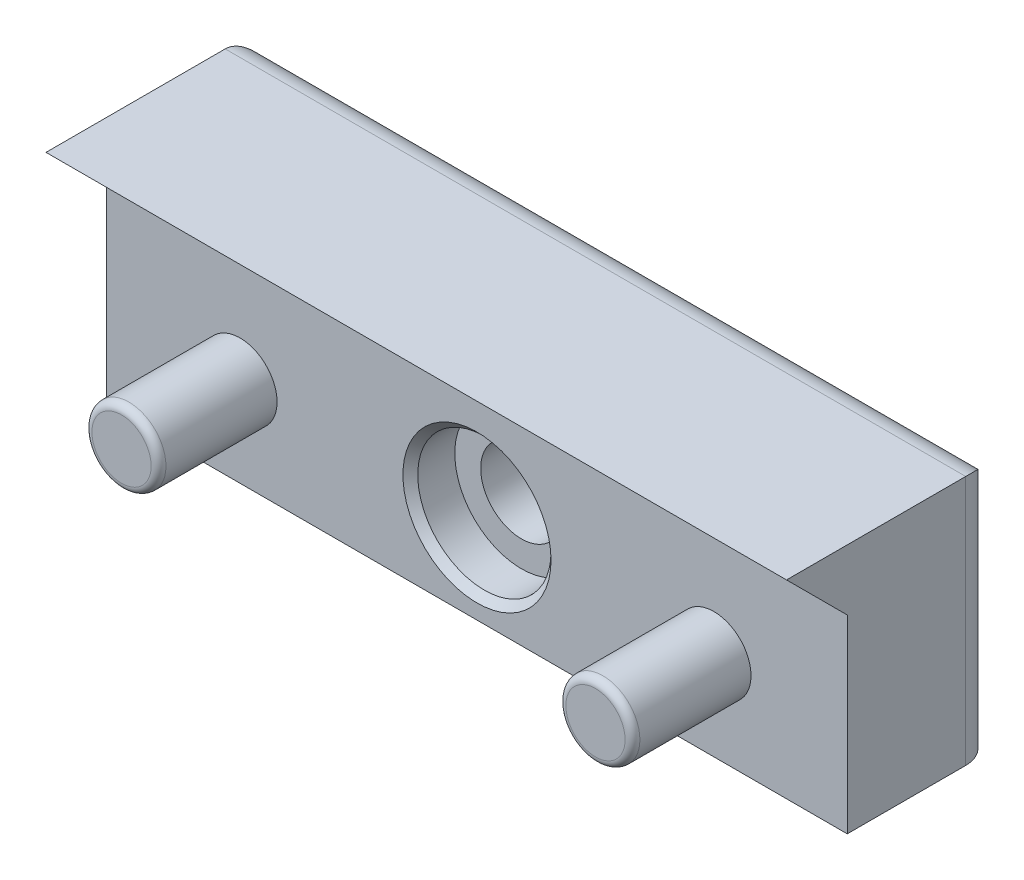
from build123d import *

# Parameters (mm, degrees)
SKETCH1_W           = 50
SKETCH1_H           = 16
BOSS_EXTRUDE1_DEPTH = 10
SKETCH2_R           = 2.75
CUT_EXTRUDE1_DEPTH  = 29.08914381
SKETCH3_R           = 2.5
BOSS_EXTRUDE2_DEPTH = 8
FILLET1_R           = 0.5
SKETCH4_W           = 50
SKETCH4_H           = 10
CUT_EXTRUDE2_DEPTH  = 2
SKETCH5_W           = 50
SKETCH5_H           = 10
BOSS_EXTRUDE3_DEPTH = 2.9
BOSS_EXTRUDE4_DEPTH = 50
FILLET2_R           = 2
SKETCH7_R           = 4.5
CUT_EXTRUDE3_DEPTH  = 3
CHAMFER1_SIZE       = 0.5


with BuildPart() as part:
    # Sketch1 → Boss-Extrude1 (new body)
    with BuildSketch(Plane.XY):
        Rectangle(SKETCH1_W, SKETCH1_H)
    extrude(amount=BOSS_EXTRUDE1_DEPTH)

    # Sketch2 → Cut-Extrude1 (cut, through all)
    with BuildSketch(Plane.XY.offset(10)):
        Circle(SKETCH2_R)
    extrude(amount=-CUT_EXTRUDE1_DEPTH, mode=Mode.SUBTRACT)

    # Sketch3 → Boss-Extrude2 (add)
    with BuildSketch(Plane.XY.offset(10)):
        with Locations((-16, 0)):
            Circle(SKETCH3_R)
        with Locations((16, 0)):
            Circle(SKETCH3_R)
    extrude(amount=BOSS_EXTRUDE2_DEPTH)

    # Fillet1
    fillet1_edges = [part.edges().sort_by_distance(p)[0] for p in [
        (-18.5, 0, 18),
        (13.5, 0, 18),
    ]]
    fillet(fillet1_edges, radius=FILLET1_R)

    # Sketch4 → Cut-Extrude2 (cut)
    with BuildSketch(Plane(origin=(0, -8, 0), x_dir=(-1, 0, 0), z_dir=(0, -1, 0))):
        with Locations((0, -5)):
            Rectangle(SKETCH4_W, SKETCH4_H)
    extrude(amount=-CUT_EXTRUDE2_DEPTH, mode=Mode.SUBTRACT)

    # Sketch5 → Boss-Extrude3 (add)
    with BuildSketch(Plane(origin=(0, 8, 0), x_dir=(1, 0, 0), z_dir=(0, 1, 0))):
        with Locations((0, -5)):
            Rectangle(SKETCH5_W, SKETCH5_H)
    extrude(amount=BOSS_EXTRUDE3_DEPTH)

    # Sketch6 → Boss-Extrude4 (add, through all)
    with BuildSketch(Plane(origin=(25, 0, 0), x_dir=(0, 0, -1), z_dir=(1, 0, 0))):
        Polygon((-14.1, 10.9), (-10, 6.8), (-10, 10.9), align=None)
    extrude(amount=-BOSS_EXTRUDE4_DEPTH)

    # Fillet2
    fillet2_edges = [part.edges().sort_by_distance(p)[0] for p in [
        (25, 2.45, 0),
        (0, 10.9, 0),
        (-25, 2.45, 0),
    ]]
    fillet(fillet2_edges, radius=FILLET2_R)

    # Sketch7 → Cut-Extrude3 (cut)
    with BuildSketch(Plane.XY.offset(10)):
        Circle(SKETCH7_R)
    extrude(amount=-CUT_EXTRUDE3_DEPTH, mode=Mode.SUBTRACT)

    # Chamfer1
    chamfer1_edges = [part.edges().sort_by_distance(p)[0] for p in [
        (-4.5, 0, 10),
    ]]
    chamfer(chamfer1_edges, length=CHAMFER1_SIZE)


solid = part.part
